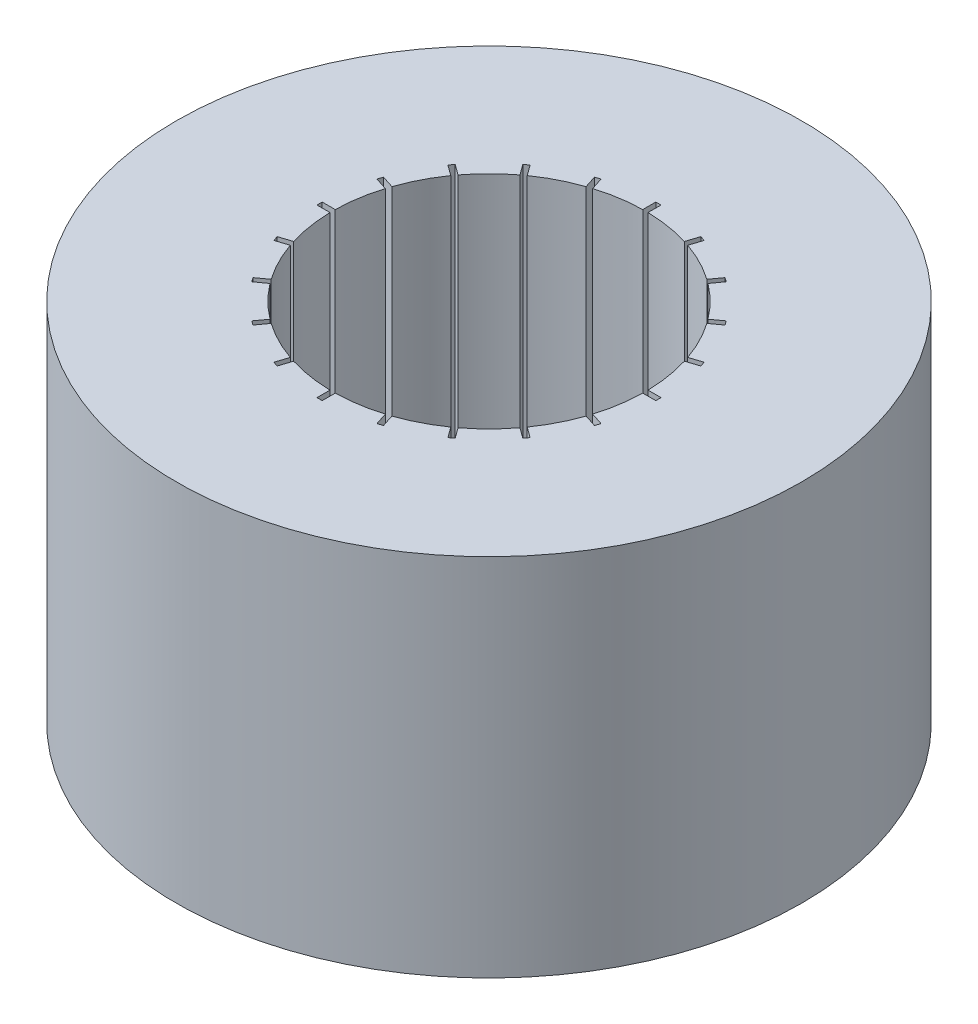
from build123d import *

# Parameters (mm, degrees)
SKETCH1_R           = 1524
SKETCH1_R_2         = 762
EXTRUDE_THIN1_DEPTH = 1778
SKETCH2_W           = 25.4
SKETCH2_H           = 127
CUT_EXTRUDE1_DEPTH  = 2795
CIRPATTERN1_COUNT   = 20
SCALE1_SCALE        = 0.02


with BuildPart() as part:
    # Sketch1 → Extrude-Thin1 (new body)
    with BuildSketch(Plane(origin=(0, 0, 0), x_dir=(1, 0, 0), z_dir=(0, 1, 0))):
        Circle(SKETCH1_R)
        Circle(SKETCH1_R_2, mode=Mode.SUBTRACT)
    extrude(amount=EXTRUDE_THIN1_DEPTH)

    # Sketch2 → Cut-Extrude1 (cut, through all)
    with BuildSketch(Plane(origin=(0, 1778, 0), x_dir=(1, 0, 0), z_dir=(0, 1, 0))):
        with Locations((0, 762)):
            Rectangle(SKETCH2_W, SKETCH2_H)
    cut_extrude1 = extrude(amount=-CUT_EXTRUDE1_DEPTH, mode=Mode.SUBTRACT)

    # CirPattern1: Cut-Extrude1 ×20 about axis
    cirpattern1_axis = Axis((0, 0, 0), (0, 1, 0))
    for i in range(1, CIRPATTERN1_COUNT):
        add(cut_extrude1.rotate(cirpattern1_axis, i * 360 / CIRPATTERN1_COUNT), mode=Mode.SUBTRACT)


with BuildPart() as part_1:
    # Scale1: scaled about (0, 889, 0)
    add(part.part.scale(SCALE1_SCALE).moved(Location((0, 871.22, 0))))


solid = part_1.part
